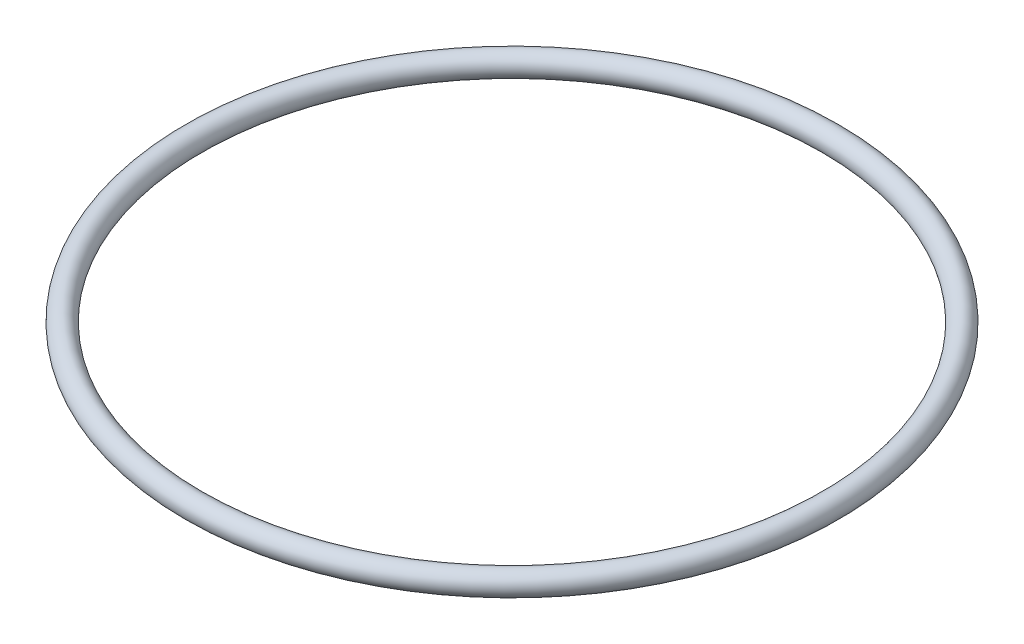
from build123d import *

# Parameters (mm, degrees)
SKETCH_1_R = 1.25


with BuildPart() as part:
    # Эскиз1 → Повернуть1 (revolve)
    with BuildSketch(Plane.XY, mode=Mode.PRIVATE) as revolve_1_sk:
        with Locations((-34.75, 0)):
            Circle(SKETCH_1_R)
    revolve(revolve_1_sk.sketch.rotate(Axis((0, 8.283775897, 0), (0, -1, 0)), 270), axis=Axis((0, 8.283775897, 0), (0, -1, 0)))


solid = part.part
